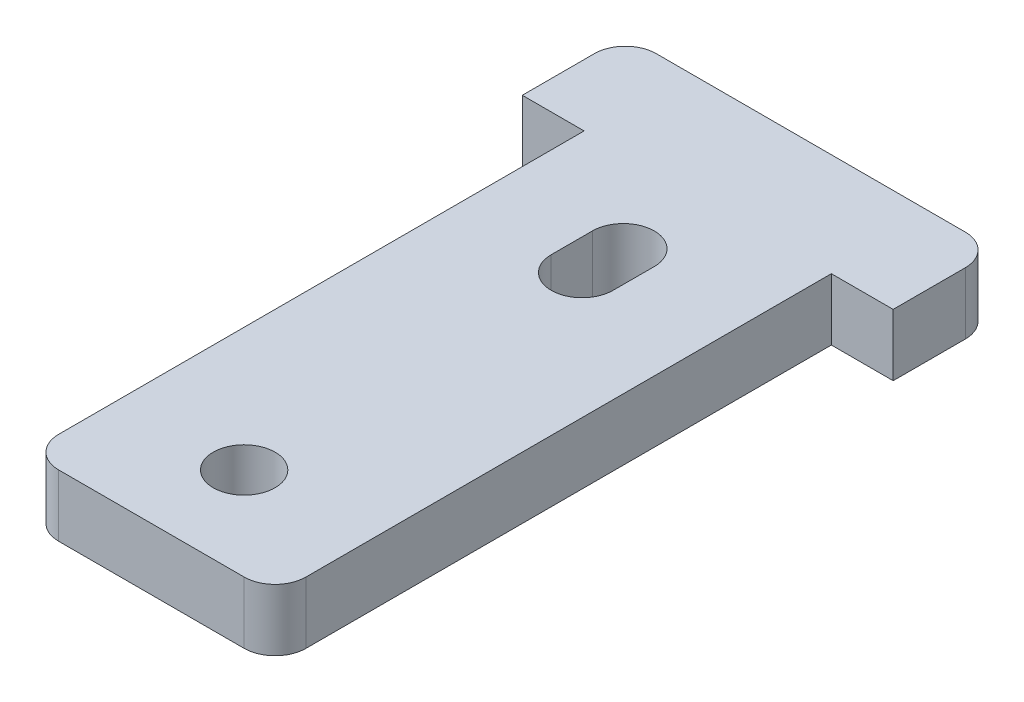
from build123d import *

# Parameters (mm, degrees)
ESQUISSE1_W             = 18
ESQUISSE1_H             = 32
BOSS_EXTRU_1_DEPTH      = 3
ENL_V_MAT_EXTRU_1_REACH = 38.837
ESQUISSE2_W             = 3
ESQUISSE2_H             = 27
ENL_V_MAT_EXTRU_2_REACH = 38.837
ESQUISSE3_W             = 3
ESQUISSE3_H             = 27
ENL_V_MAT_EXTRU_3_REACH = 38.837
ESQUISSE4_R             = 1.5
CONG_1_R                = 1.5
CONG_2_R                = 1.5
ENL_V_MAT_EXTRU_4_REACH = 38.837


with BuildPart() as part:
    # Esquisse1 → Boss.-Extru.1 (new body)
    with BuildSketch(Plane(origin=(0, 0, 0), x_dir=(1, 0, 0), z_dir=(0, 1, 0))):
        with Locations((9, 16)):
            Rectangle(ESQUISSE1_W, ESQUISSE1_H)
    extrude(amount=BOSS_EXTRU_1_DEPTH)

    # Esquisse2 → Enlèv. mat.-Extru.1 (cut, up to next)
    with BuildSketch(Plane(origin=(0, 3, 0), x_dir=(1, 0, 0), z_dir=(0, 1, 0)), mode=Mode.PRIVATE) as enl_v_mat_extru_1_sk1:
        with Locations((1.5, 13.5)):
            Rectangle(ESQUISSE2_W, ESQUISSE2_H)
    enl_v_mat_extru_1_tool1 = extrude(enl_v_mat_extru_1_sk1.sketch, amount=-ENL_V_MAT_EXTRU_1_REACH, mode=Mode.PRIVATE) & part.part
    add(enl_v_mat_extru_1_tool1.solids().sort_by_distance((1.5, 3, -13.5))[0], mode=Mode.SUBTRACT)

    # Esquisse3 → Enlèv. mat.-Extru.2 (cut, up to next)
    with BuildSketch(Plane(origin=(0, 3, 0), x_dir=(1, 0, 0), z_dir=(0, 1, 0)), mode=Mode.PRIVATE) as enl_v_mat_extru_2_sk1:
        with Locations((16.5, 13.5)):
            Rectangle(ESQUISSE3_W, ESQUISSE3_H)
    enl_v_mat_extru_2_tool1 = extrude(enl_v_mat_extru_2_sk1.sketch, amount=-ENL_V_MAT_EXTRU_2_REACH, mode=Mode.PRIVATE) & part.part
    add(enl_v_mat_extru_2_tool1.solids().sort_by_distance((16.5, 3, -13.5))[0], mode=Mode.SUBTRACT)

    # Esquisse4 → Enlèv. mat.-Extru.3 (cut, up to next)
    with BuildSketch(Plane(origin=(0, 3, 0), x_dir=(1, 0, 0), z_dir=(0, 1, 0)), mode=Mode.PRIVATE) as enl_v_mat_extru_3_sk1:
        with Locations(Location((9, 4.5, 0), (0, 0, 270))):
            Circle(ESQUISSE4_R)
    enl_v_mat_extru_3_tool1 = extrude(enl_v_mat_extru_3_sk1.sketch, amount=-ENL_V_MAT_EXTRU_3_REACH, mode=Mode.PRIVATE) & part.part
    add(enl_v_mat_extru_3_tool1.solids().sort_by_distance((9, 3, -4.5))[0], mode=Mode.SUBTRACT)

    # Congé1
    cong_1_edges = [part.edges().sort_by_distance(p)[0] for p in [
        (0, 1.5, -32),
        (18, 1.5, -32),
    ]]
    fillet(cong_1_edges, radius=CONG_1_R)

    # Congé2
    cong_2_edges = [part.edges().sort_by_distance(p)[0] for p in [
        (3, 1.5, 0),
        (15, 1.5, 0),
    ]]
    fillet(cong_2_edges, radius=CONG_2_R)

    # Esquisse5 → Enlèv. mat.-Extru.4 (cut, up to next)
    with BuildSketch(Plane(origin=(0, 3, 0), x_dir=(1, 0, 0), z_dir=(0, 1, 0)), mode=Mode.PRIVATE) as enl_v_mat_extru_4_sk1:
        with BuildLine():
            Line((10.403583012, 23), (10.403583012, 21))
            ThreePointArc((10.403583012, 21), (8.903583012, 19.5), (7.403583012, 21))
            Line((7.403583012, 21), (7.403583012, 23))
            ThreePointArc((7.403583012, 23), (8.903583012, 24.5), (10.403583012, 23))
        make_face()
    enl_v_mat_extru_4_tool1 = extrude(enl_v_mat_extru_4_sk1.sketch, amount=-ENL_V_MAT_EXTRU_4_REACH, mode=Mode.PRIVATE) & part.part
    add(enl_v_mat_extru_4_tool1.solids().sort_by_distance((8.903583, 3, -22))[0], mode=Mode.SUBTRACT)


solid = part.part
